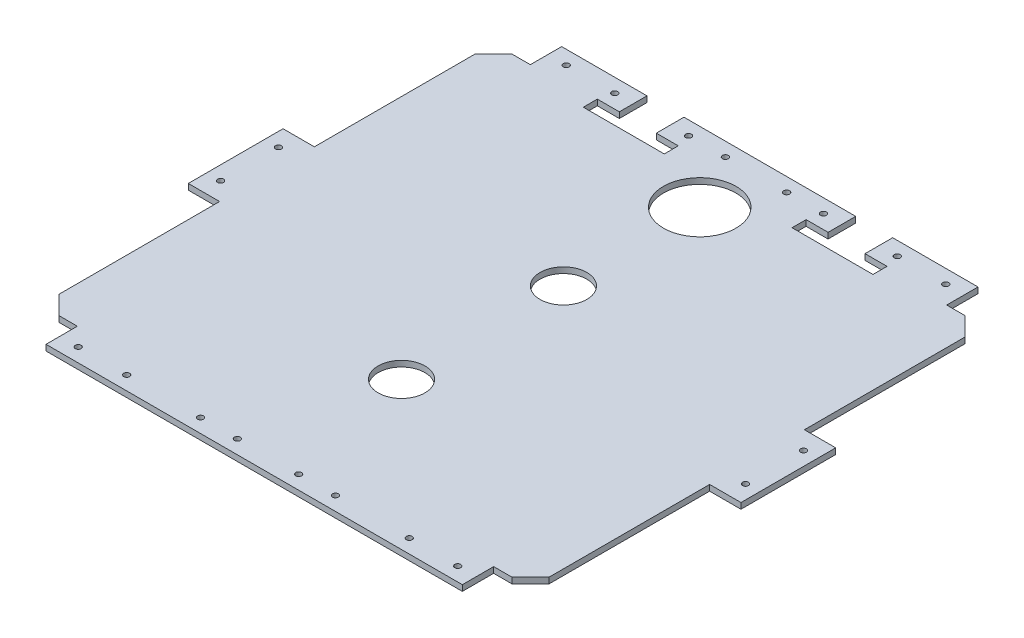
from build123d import *

# Parameters (mm, degrees)
SKETCH1_W           = 300
SKETCH1_H           = 279.908
BOSS_EXTRUDE1_DEPTH = 3.175
SKETCH2_W           = 17
SKETCH2_H           = 17
SKETCH2_W_2         = 20.066
SKETCH2_H_2         = 15
SKETCH2_W_3         = 43.942
SKETCH2_H_3         = 7.62
CUT_EXTRUDE1_DEPTH  = 3.175
SKETCH3_R           = 12.7
SKETCH3_R_2         = 19.685
SKETCH3_R_3         = 1.6
CUT_EXTRUDE2_DEPTH  = 3.175


with BuildPart() as part:
    # Sketch1 → Boss-Extrude1 (new body)
    with BuildSketch(Plane(origin=(0, 0, 0), x_dir=(1, 0, 0), z_dir=(0, 1, 0))):
        with Locations((150, 139.954)):
            Rectangle(SKETCH1_W, SKETCH1_H)
    extrude(amount=BOSS_EXTRUDE1_DEPTH)

    # Sketch2 → Cut-Extrude1 (cut)
    with BuildSketch(Plane(origin=(0, 3.175, 0), x_dir=(1, 0, 0), z_dir=(0, 1, 0))):
        Polygon((283, 27), (273, 17), (283, 17), align=None)
        Polygon((273, 17), (263, 17), (263, 0), (283, 0), (283, 17), align=None)
        with Locations((291.5, 8.5)):
            Rectangle(SKETCH2_W, SKETCH2_H)
        Polygon((283, 27), (283, 17), (300, 17), (300, 114.24), (283, 114.24), align=None)
        Polygon((273, 262.908), (283, 252.908), (283, 262.908), align=None)
        Polygon((283, 165.668), (300, 165.668), (300, 262.908), (283, 262.908), (283, 252.908), align=None)
        with Locations((291.5, 271.408)):
            Rectangle(SKETCH2_W, SKETCH2_H)
        Polygon((283, 279.908), (263, 279.908), (263, 262.908), (273, 262.908), (283, 262.908), align=None)
        Polygon((17, 17), (27, 17), (17, 27), align=None)
        Polygon((17, 0), (37, 0), (37, 17), (27, 17), (17, 17), align=None)
        with Locations((8.5, 8.5)):
            Rectangle(SKETCH2_W, SKETCH2_H)
        Polygon((17, 114.24), (0, 114.24), (0, 17), (17, 17), (17, 27), align=None)
        Polygon((27, 262.908), (17, 262.908), (17, 252.908), align=None)
        Polygon((37, 262.908), (37, 279.908), (17, 279.908), (17, 262.908), (27, 262.908), align=None)
        with Locations((8.5, 271.408)):
            Rectangle(SKETCH2_W, SKETCH2_H)
        Polygon((0, 262.908), (0, 165.668), (17, 165.668), (17, 252.908), (17, 262.908), align=None)
        with Locations((93.345, 272.408)):
            Rectangle(SKETCH2_W_2, SKETCH2_H_2)
        Polygon((115.316, 264.908), (103.378, 264.908), (83.312, 264.908), (71.374, 264.908), (71.374, 257.288), (115.316, 257.288), align=None)
        with Locations((206.655, 272.408)):
            Rectangle(SKETCH2_W_2, SKETCH2_H_2)
        with Locations((206.655, 261.098)):
            Rectangle(SKETCH2_W_3, SKETCH2_H_3)
    extrude(amount=-CUT_EXTRUDE1_DEPTH, mode=Mode.SUBTRACT)

    # Sketch3 → Cut-Extrude2 (cut)
    with BuildSketch(Plane(origin=(0, 3.175, 0), x_dir=(1, 0, 0), z_dir=(0, 1, 0))):
        with Locations(Location((150, 167.873621066, 0), (0, 0, 270))):
            Circle(SKETCH3_R)
        with BuildLine():
            ThreePointArc((150, 180.573621066), (137.3, 167.873621066), (150, 155.173621066))
            Line((150, 155.173621066), (150, 180.573621066))
        make_face()
        with BuildLine():
            Line((150, 180.573621066), (150, 155.173621066))
            ThreePointArc((150, 155.173621066), (158.980256121, 158.893364945), (162.7, 167.873621066))
            ThreePointArc((162.7, 167.873621066), (158.980256121, 176.853877188), (150, 180.573621066))
        make_face()
        with Locations(Location((150, 241.858, 0), (0, 0, 270))):
            Circle(SKETCH3_R_2)
        with Locations(Location((150, 80, 0), (0, 0, 270))):
            Circle(SKETCH3_R)
        with Locations(Location((7.5, 155.668, 0), (0, 0, 270))):
            Circle(SKETCH3_R_3)
        with Locations(Location((7.5, 124.24, 0), (0, 0, 90))):
            Circle(SKETCH3_R_3)
        with Locations(Location((47, 7.5, 0), (0, 0, 90))):
            Circle(SKETCH3_R_3)
        with Locations(Location((73.312, 7.5, 0), (0, 0, 90))):
            Circle(SKETCH3_R_3)
        with Locations(Location((113.378, 7.5, 0), (0, 0, 90))):
            Circle(SKETCH3_R_3)
        with Locations(Location((133.378, 7.5, 0), (0, 0, 90))):
            Circle(SKETCH3_R_3)
        with Locations(Location((166.622, 7.5, 0), (0, 0, 270))):
            Circle(SKETCH3_R_3)
        with Locations(Location((186.622, 7.5, 0), (0, 0, 270))):
            Circle(SKETCH3_R_3)
        with Locations(Location((226.688, 7.5, 0), (0, 0, 270))):
            Circle(SKETCH3_R_3)
        with Locations(Location((253, 7.5, 0), (0, 0, 270))):
            Circle(SKETCH3_R_3)
        with Locations(Location((47, 272.408, 0), (0, 0, 270))):
            Circle(SKETCH3_R_3)
        with Locations(Location((73.312, 272.408, 0), (0, 0, 270))):
            Circle(SKETCH3_R_3)
        with Locations(Location((113.378, 272.408, 0), (0, 0, 270))):
            Circle(SKETCH3_R_3)
        with Locations(Location((133.378, 272.408, 0), (0, 0, 270))):
            Circle(SKETCH3_R_3)
        with Locations(Location((166.622, 272.408, 0), (0, 0, 90))):
            Circle(SKETCH3_R_3)
        with Locations(Location((186.622, 272.408, 0), (0, 0, 90))):
            Circle(SKETCH3_R_3)
        with Locations(Location((226.688, 272.408, 0), (0, 0, 90))):
            Circle(SKETCH3_R_3)
        with Locations(Location((253, 272.408, 0), (0, 0, 90))):
            Circle(SKETCH3_R_3)
        with Locations(Location((292.5, 155.668, 0), (0, 0, 90))):
            Circle(SKETCH3_R_3)
        with Locations(Location((292.5, 124.24, 0), (0, 0, 270))):
            Circle(SKETCH3_R_3)
    extrude(amount=-CUT_EXTRUDE2_DEPTH, mode=Mode.SUBTRACT)


solid = part.part
